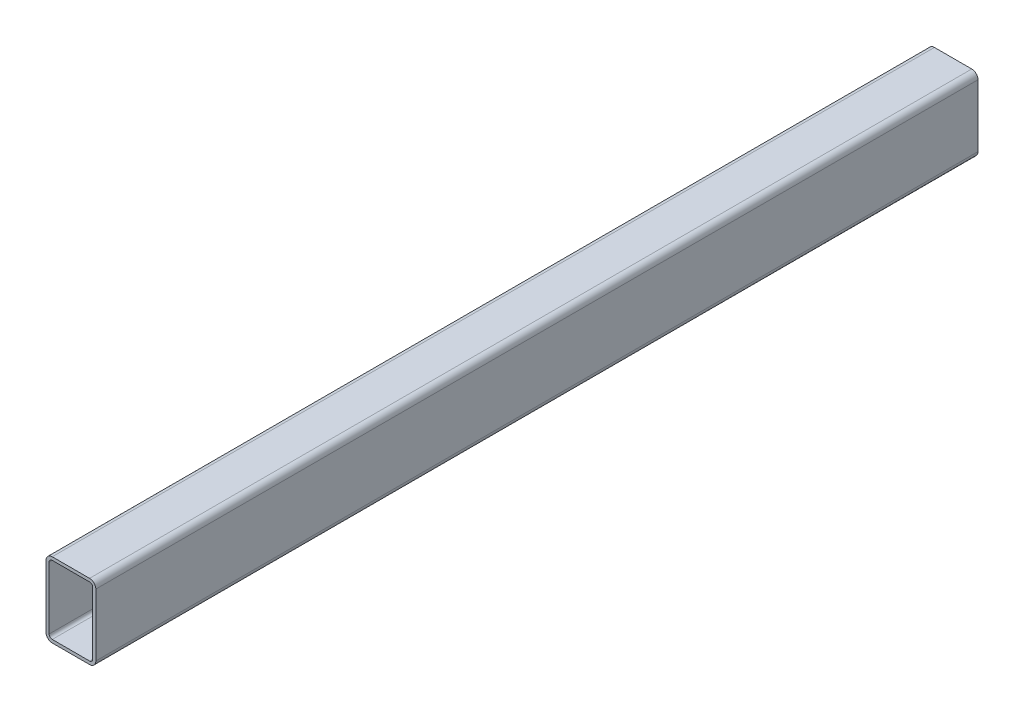
from build123d import *

# Parameters (mm, degrees)
CNC_3X2X0_125_1_DEPTH = 900


with BuildPart() as part:
    # Sketch11 → Cnc 3X2X0.125(1) (new body)
    with BuildSketch(Plane.YX.offset(-450)):
        with BuildLine():
            Line((31.75, -25.4), (-31.75, -25.4))
            ThreePointArc((-31.75, -25.4), (-36.240128061, -23.540128061), (-38.1, -19.05))
            Line((-38.1, -19.05), (-38.1, 19.05))
            ThreePointArc((-38.1, 19.05), (-36.240128061, 23.540128061), (-31.75, 25.4))
            Line((-31.75, 25.4), (31.75, 25.4))
            ThreePointArc((31.75, 25.4), (36.240128061, 23.540128061), (38.1, 19.05))
            Line((38.1, 19.05), (38.1, -19.05))
            ThreePointArc((38.1, -19.05), (36.240128061, -23.540128061), (31.75, -25.4))
        make_face()
        with BuildLine():
            Line((31.75, 22.225), (-31.75, 22.225))
            ThreePointArc((-31.75, 22.225), (-33.99506403, 21.29506403), (-34.925, 19.05))
            Line((-34.925, 19.05), (-34.925, -19.05))
            ThreePointArc((-34.925, -19.05), (-33.99506403, -21.29506403), (-31.75, -22.225))
            Line((-31.75, -22.225), (31.75, -22.225))
            ThreePointArc((31.75, -22.225), (33.99506403, -21.29506403), (34.925, -19.05))
            Line((34.925, -19.05), (34.925, 19.05))
            ThreePointArc((34.925, 19.05), (33.99506403, 21.29506403), (31.75, 22.225))
        make_face(mode=Mode.SUBTRACT)
    extrude(amount=CNC_3X2X0_125_1_DEPTH)


solid = part.part
